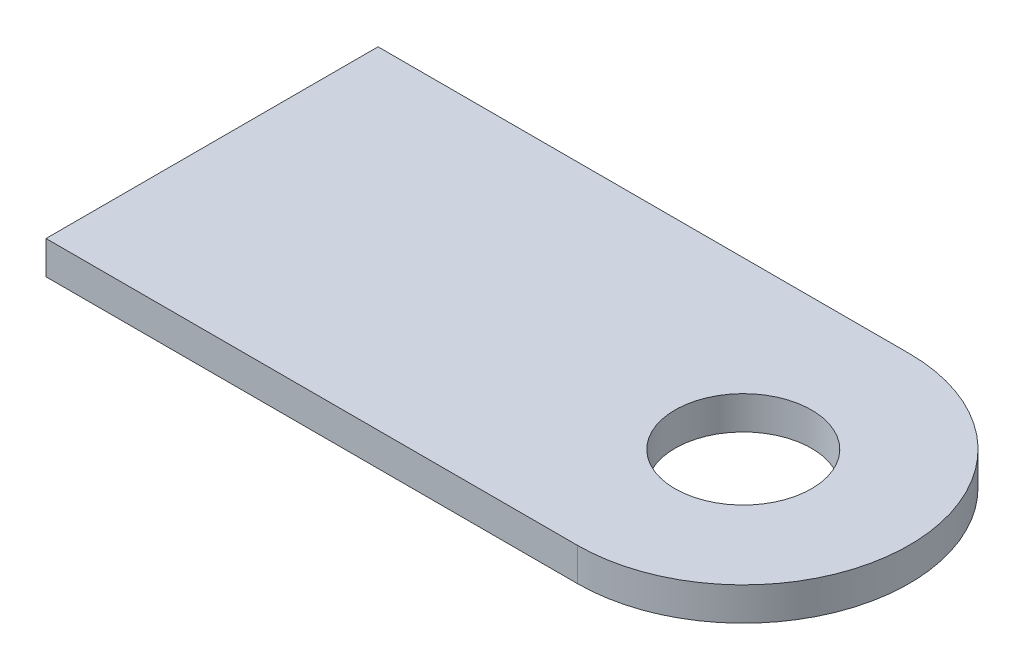
from build123d import *

# Parameters (mm, degrees)
SKETCH1_R           = 3.2639
BOSS_EXTRUDE1_DEPTH = 1.5875


with BuildPart() as part:
    # Sketch1 → Boss-Extrude1 (new body)
    with BuildSketch(Plane(origin=(0, 0, 0), x_dir=(1, 0, 0), z_dir=(0, 1, 0))):
        with BuildLine():
            Line((0, 0), (0, 15.875))
            Line((0, 15.875), (25.4, 15.875))
            ThreePointArc((25.4, 15.875), (33.3375, 7.9375), (25.4, 0))
            Line((25.4, 0), (0, 0))
        make_face()
        with Locations(Location((25.4, 7.9375, 0), (0, 0, 270))):
            Circle(SKETCH1_R, mode=Mode.SUBTRACT)
    extrude(amount=BOSS_EXTRUDE1_DEPTH)


solid = part.part
